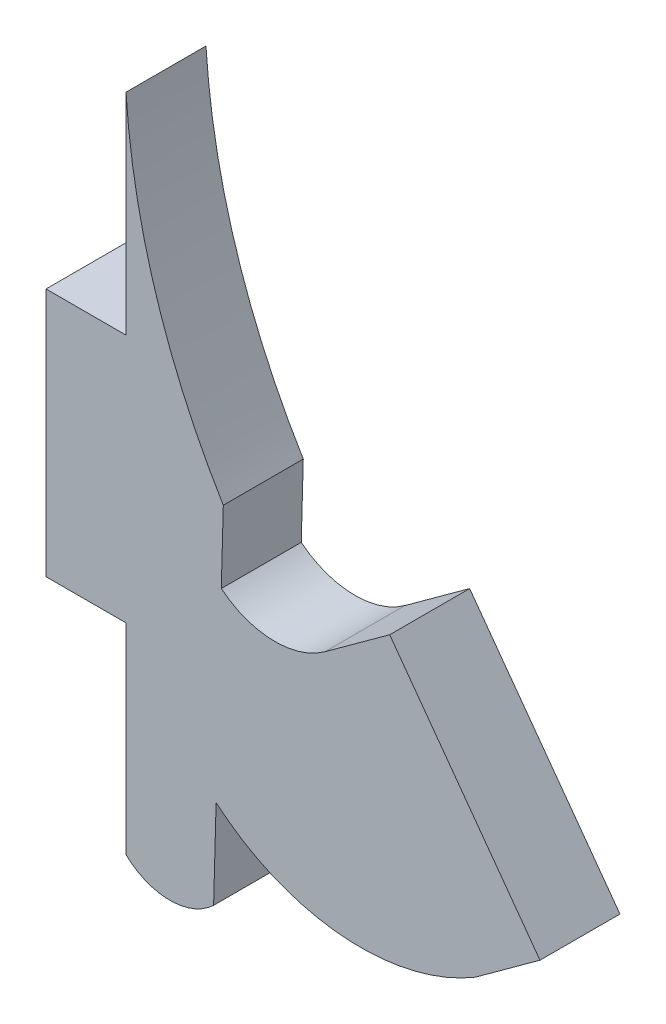
from build123d import *

# Parameters (mm, degrees)
BOSS_EXTRUDE1_DEPTH = 1.524


with BuildPart() as part:
    # Sketch1 → Boss-Extrude1 (new body)
    with BuildSketch(Plane.XY):
        with BuildLine():
            Line((1.524, 26.967680282), (0, 26.967680282))
            Line((0, 26.967680282), (0, 22.217880282))
            Line((0, 22.217880282), (1.524, 22.217880282))
            Line((1.524, 22.217880282), (1.524, 18.391271339))
            ThreePointArc((1.524, 18.391271339), (2.358852733, 18.057327031), (3.193705465, 18.391271339))
            Line((3.193705465, 18.391271339), (3.241105721, 20.110110457))
            ThreePointArc((3.241105721, 20.110110457), (5.645287311, 19.111172108), (8.181482071, 19.699120308))
            Line((8.181482071, 19.699120308), (9.414013694, 20.595469457))
            Line((9.414013694, 20.595469457), (6.54906828, 24.534934144))
            Line((6.54906828, 24.534934144), (5.316536657, 23.638584995))
            ThreePointArc((5.316536657, 23.638584995), (4.31894521, 23.329334303), (3.339913307, 23.693094141))
            Line((3.339913307, 23.693094141), (3.378365348, 25.087450992))
            ThreePointArc((3.378365348, 25.087450992), (2.095759725, 27.920506851), (1.524, 30.977363652))
            Line((1.524, 30.977363652), (1.524, 26.967680282))
        make_face()
    extrude(amount=BOSS_EXTRUDE1_DEPTH)


solid = part.part
